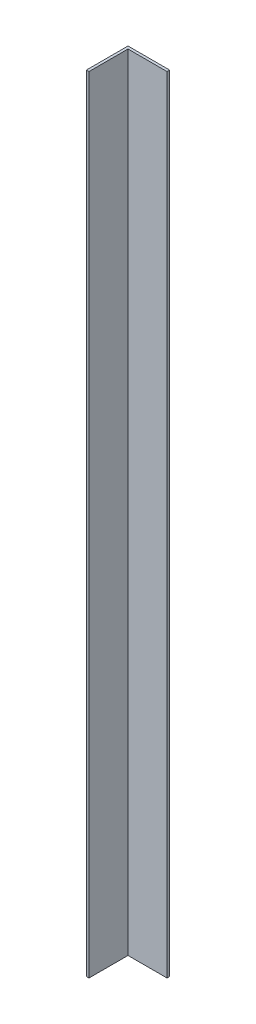
from build123d import *

# Parameters (mm, degrees)
SKETCH1_W           = 25.4
SKETCH1_H           = 25.4
BOSS_EXTRUDE1_DEPTH = 479.425
SKETCH2_W           = 23.8125
SKETCH2_H           = 23.8125
CUT_EXTRUDE1_DEPTH  = 481.768812034


with BuildPart() as part:
    # Sketch1 → Boss-Extrude1 (new body)
    with BuildSketch(Plane(origin=(0, 0, 0), x_dir=(1, 0, 0), z_dir=(0, 1, 0))):
        with Locations((12.7, -12.7)):
            Rectangle(SKETCH1_W, SKETCH1_H)
    extrude(amount=BOSS_EXTRUDE1_DEPTH)

    # Sketch2 → Cut-Extrude1 (cut, through all)
    with BuildSketch(Plane(origin=(0, 479.425, 0), x_dir=(1, 0, 0), z_dir=(0, 1, 0))):
        with Locations((13.49375, -13.49375)):
            Rectangle(SKETCH2_W, SKETCH2_H)
    extrude(amount=-CUT_EXTRUDE1_DEPTH, mode=Mode.SUBTRACT)


solid = part.part
